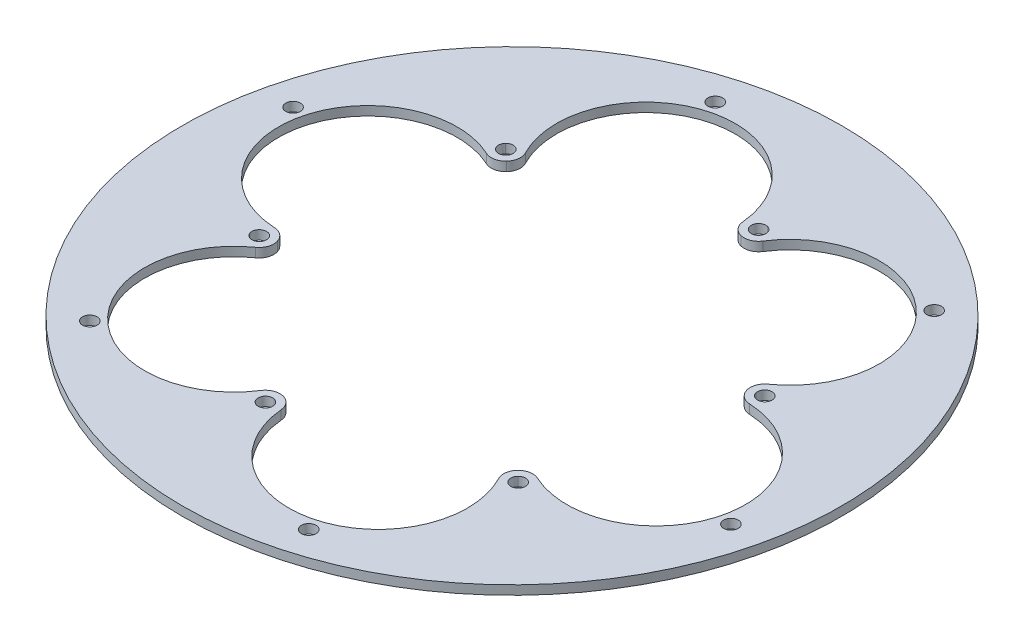
from build123d import *

# Parameters (mm, degrees)
SKETCH1_R           = 90.5
SKETCH1_R_2         = 2
BOSS_EXTRUDE1_DEPTH = 2.5


with BuildPart() as part:
    # Sketch1 → Boss-Extrude1 (new body)
    with BuildSketch(Plane(origin=(0, 0, 0), x_dir=(1, 0, 0), z_dir=(0, 1, 0))):
        with Locations(Location((0, 0, 0), (0, 0, 270))):
            Circle(SKETCH1_R)
        with Locations(Location((-56.728619257, -59.210334885, 0), (0, 0, 270))):
            Circle(SKETCH1_R_2, mode=Mode.SUBTRACT)
        with BuildLine():
            ThreePointArc((-13.809474495, -56.333511054), (-15.279862915, -53.913851845), (-12.857122546, -52.448545769))
            ThreePointArc((-12.857122546, -52.448545769), (-11.756930203, -53.155944826), (-11.329221048, -54.392027954))
            ThreePointArc((-11.329221048, -54.392027954), (-12.096441038, -55.966909996), (-13.809474495, -56.333511054))
        make_face(mode=Mode.SUBTRACT)
        with BuildLine():
            ThreePointArc((-55.690988904, -16.207399802), (-54.330696771, -13.724176472), (-51.8503343, -15.08967814))
            ThreePointArc((-51.8503343, -15.08967814), (-51.789803118, -15.36823597), (-51.769488495, -15.652569937))
            ThreePointArc((-51.769488495, -15.652569937), (-53.48931071, -17.632847798), (-55.690988904, -16.207399802))
        make_face(mode=Mode.SUBTRACT)
        with Locations(Location((22.913344548, -78.733592841, 0), (0, 0, 270))):
            Circle(SKETCH1_R_2, mode=Mode.SUBTRACT)
        with BuildLine():
            ThreePointArc((41.88151441, -40.126111252), (39.050833856, -40.189675373), (38.993211754, -37.358867629))
            ThreePointArc((38.993211754, -37.358867629), (41.183869698, -36.882833205), (42.440267447, -38.739458017))
            ThreePointArc((42.440267447, -38.739458017), (42.295327275, -39.486955868), (41.88151441, -40.126111252))
        make_face(mode=Mode.SUBTRACT)
        with Locations(Location((79.641963805, -19.523257956, 0), (0, 0, 270))):
            Circle(SKETCH1_R_2, mode=Mode.SUBTRACT)
        with Locations(Location((-79.641963805, 19.523257956, 0), (0, 0, 270))):
            Circle(SKETCH1_R_2, mode=Mode.SUBTRACT)
        with BuildLine():
            ThreePointArc((-38.993211754, 37.358867629), (-41.823892307, 37.295303508), (-41.88151441, 40.126111252))
            ThreePointArc((-41.88151441, 40.126111252), (-39.690856466, 40.602145676), (-38.434458716, 38.745520864))
            ThreePointArc((-38.434458716, 38.745520864), (-38.579398889, 37.998023012), (-38.993211754, 37.358867629))
        make_face(mode=Mode.SUBTRACT)
        with Locations(Location((-22.913344548, 78.733592841, 0), (0, 0, 270))):
            Circle(SKETCH1_R_2, mode=Mode.SUBTRACT)
        with BuildLine():
            ThreePointArc((-36.887220248, 40.576808173), (-21.946513181, 75.411419289), (9.353262234, 54.033886264))
            ThreePointArc((9.353262234, 54.033886264), (10.301978002, 51.784964754), (12.380944998, 50.506056707))
            ThreePointArc((12.380944998, 50.506056707), (14.815689048, 50.678483436), (16.696936559, 52.233673896))
            ThreePointArc((16.696936559, 52.233673896), (54.33494825, 56.711947584), (51.471349286, 18.916780429))
            ThreePointArc((51.471349286, 18.916780429), (49.998084012, 16.970707718), (49.930000652, 14.530815462))
            ThreePointArc((49.930000652, 14.530815462), (51.296698605, 12.508478628), (53.584156807, 11.656865723))
            ThreePointArc((53.584156807, 11.656865723), (76.28146143, -18.699471706), (42.118087053, -35.117105834))
            ThreePointArc((42.118087053, -35.117105834), (39.69610601, -34.814257036), (37.549055654, -35.975241245))
            ThreePointArc((37.549055654, -35.975241245), (36.481009557, -38.170004808), (36.887220248, -40.576808173))
            ThreePointArc((36.887220248, -40.576808173), (21.946513181, -75.411419289), (-9.353262234, -54.033886264))
            ThreePointArc((-9.353262234, -54.033886264), (-10.301978002, -51.784964754), (-12.380944998, -50.506056707))
            ThreePointArc((-12.380944998, -50.506056707), (-14.815689048, -50.678483436), (-16.696936559, -52.233673896))
            ThreePointArc((-16.696936559, -52.233673896), (-54.33494825, -56.711947584), (-51.471349286, -18.916780429))
            ThreePointArc((-51.471349286, -18.916780429), (-49.998084012, -16.970707718), (-49.930000652, -14.530815462))
            ThreePointArc((-49.930000652, -14.530815462), (-51.296698605, -12.508478628), (-53.584156807, -11.656865723))
            ThreePointArc((-53.584156807, -11.656865723), (-76.28146143, 18.699471706), (-42.118087053, 35.117105834))
            ThreePointArc((-42.118087053, 35.117105834), (-39.69610601, 34.814257036), (-37.549055654, 35.975241245))
            ThreePointArc((-37.549055654, 35.975241245), (-36.481009557, 38.170004808), (-36.887220248, 40.576808173))
        make_face(mode=Mode.SUBTRACT)
        with BuildLine():
            ThreePointArc((55.690988904, 16.207399802), (55.751520087, 15.928841972), (55.771834709, 15.644508005))
            ThreePointArc((55.771834709, 15.644508005), (54.052012494, 13.664230143), (51.8503343, 15.08967814))
            ThreePointArc((51.8503343, 15.08967814), (53.210626433, 17.572901469), (55.690988904, 16.207399802))
        make_face(mode=Mode.SUBTRACT)
        with BuildLine():
            ThreePointArc((13.809474495, 56.333511054), (14.909666838, 55.626111996), (15.337375993, 54.390028868))
            ThreePointArc((15.337375993, 54.390028868), (14.570156003, 52.815146826), (12.857122546, 52.448545769))
            ThreePointArc((12.857122546, 52.448545769), (11.386734126, 54.868204977), (13.809474495, 56.333511054))
        make_face(mode=Mode.SUBTRACT)
        with Locations(Location((56.728619257, 59.210334885, 0), (0, 0, 270))):
            Circle(SKETCH1_R_2, mode=Mode.SUBTRACT)
    extrude(amount=BOSS_EXTRUDE1_DEPTH)


solid = part.part
